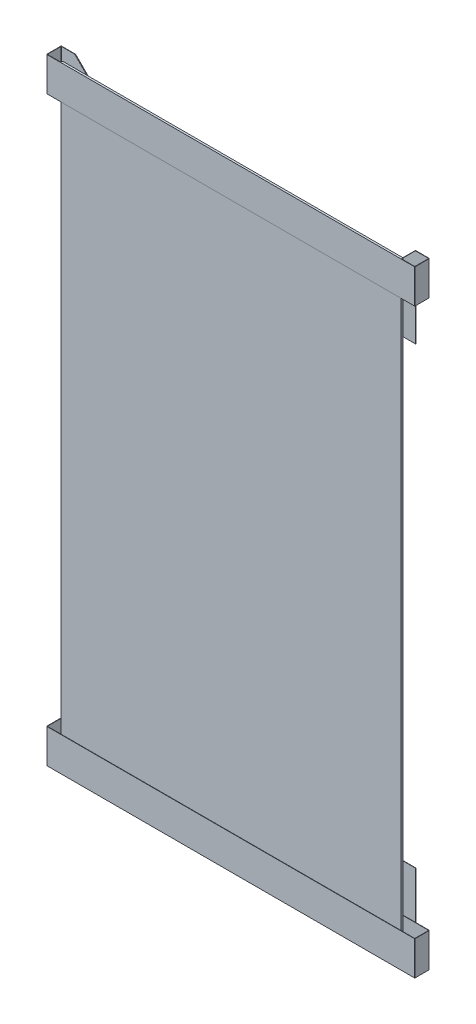
from build123d import *

# Parameters (mm, degrees)
SKETCH1_W            = 50
SKETCH1_H            = 88
BOSS_EXTRUDE1_DEPTH  = 0.25
BOSS_EXTRUDE2_DEPTH  = 5
SKETCH5_W            = 5
SKETCH5_H            = 11.9
BOSS_EXTRUDE3_DEPTH  = 0.05
CUT_EXTRUDE1_DEPTH   = 0.2
FILLET1_R            = 0.04
FILLET1_OF_MIRROR1_R = 0.04


with BuildPart() as part:
    # Sketch1 → Boss-Extrude1 (new body)
    with BuildSketch(Plane.XY.offset(0.25)):
        with Locations((0, 1.25)):
            Rectangle(SKETCH1_W, SKETCH1_H)
    extrude(amount=-BOSS_EXTRUDE1_DEPTH)

    # Sketch4 → Boss-Extrude2 (add)
    with BuildSketch(Plane(origin=(0, -45.25, 0), x_dir=(-1, 0, 0), z_dir=(0, -1, 0))):
        with BuildLine():
            Line((-26.95, -0.25), (26.95, -0.25))
            ThreePointArc((26.95, -0.25), (26.985355339, -0.235355339), (27, -0.2))
            Line((27, -0.2), (27, 1.75))
            ThreePointArc((27, 1.75), (26.985355339, 1.785355339), (26.95, 1.8))
            Line((26.95, 1.8), (20, 1.8))
            Line((20, 1.8), (20, 1.85))
            Line((20, 1.85), (27, 1.85))
            ThreePointArc((27, 1.85), (27.035355339, 1.835355339), (27.05, 1.8))
            Line((27.05, 1.8), (27.05, -0.25))
            ThreePointArc((27.05, -0.25), (27.035355339, -0.285355339), (27, -0.3))
            Line((27, -0.3), (-27, -0.3))
            ThreePointArc((-27, -0.3), (-27.035355339, -0.285355339), (-27.05, -0.25))
            Line((-27.05, -0.25), (-27.05, 1.8))
            ThreePointArc((-27.05, 1.8), (-27.035355339, 1.835355339), (-27, 1.85))
            Line((-27, 1.85), (-20, 1.85))
            Line((-20, 1.85), (-20, 1.8))
            Line((-20, 1.8), (-26.95, 1.8))
            ThreePointArc((-26.95, 1.8), (-26.985355339, 1.785355339), (-27, 1.75))
            Line((-27, 1.75), (-27, -0.2))
            ThreePointArc((-27, -0.2), (-26.985355339, -0.235355339), (-26.95, -0.25))
        make_face()
    boss_extrude2 = extrude(amount=-BOSS_EXTRUDE2_DEPTH)

    # Sketch5 → Boss-Extrude3 (add)
    with BuildSketch(Plane(origin=(0, 0, -1.85), x_dir=(-1, 0, 0), z_dir=(0, 0, -1))):
        with Locations((22.5, -39.3)):
            Rectangle(SKETCH5_W, SKETCH5_H)
        with Locations((-22.5, -39.3)):
            Rectangle(SKETCH5_W, SKETCH5_H)
    boss_extrude3 = extrude(amount=BOSS_EXTRUDE3_DEPTH)

    # Sketch6 → Cut-Extrude1 (cut)
    with BuildSketch(Plane(origin=(0, 0, -1.9), x_dir=(-1, 0, 0), z_dir=(0, 0, -1))):
        Polygon((20, -45.25), (25, -45.25), (20, -40.254912883), align=None)
        Polygon((-20, -40.254912883), (-25, -45.25), (-20, -45.25), align=None)
    cut_extrude1 = extrude(amount=-CUT_EXTRUDE1_DEPTH, mode=Mode.SUBTRACT)

    # Fillet1
    fillet1_edges = [part.edges().sort_by_distance(p)[0] for p in [
        (-22.5, -42.752456442, -1.8),
        (-22.5, -42.752456442, -1.9),
        (22.5, -42.752456442, -1.9),
        (22.5, -42.752456442, -1.8),
    ]]
    fillet(fillet1_edges, radius=FILLET1_R)

    # Mirror1: Boss-Extrude2, Boss-Extrude3, Cut-Extrude1 across plane
    add(boss_extrude2.mirror(Plane(origin=(0, 0, 0), x_dir=(0, 0, 1), z_dir=(0, -1, 0))))
    add(boss_extrude3.mirror(Plane(origin=(0, 0, 0), x_dir=(0, 0, 1), z_dir=(0, -1, 0))))
    add(cut_extrude1.mirror(Plane(origin=(0, 0, 0), x_dir=(0, 0, 1), z_dir=(0, -1, 0))), mode=Mode.SUBTRACT)

    # Fillet1 of Mirror1
    fillet1_of_mirror1_edges = [part.edges().sort_by_distance(p)[0] for p in [
        (-22.5, 42.752456442, -1.8),
        (-22.5, 42.752456442, -1.9),
        (22.5, 42.752456442, -1.9),
        (22.5, 42.752456442, -1.8),
    ]]
    fillet(fillet1_of_mirror1_edges, radius=FILLET1_OF_MIRROR1_R)


solid = part.part
